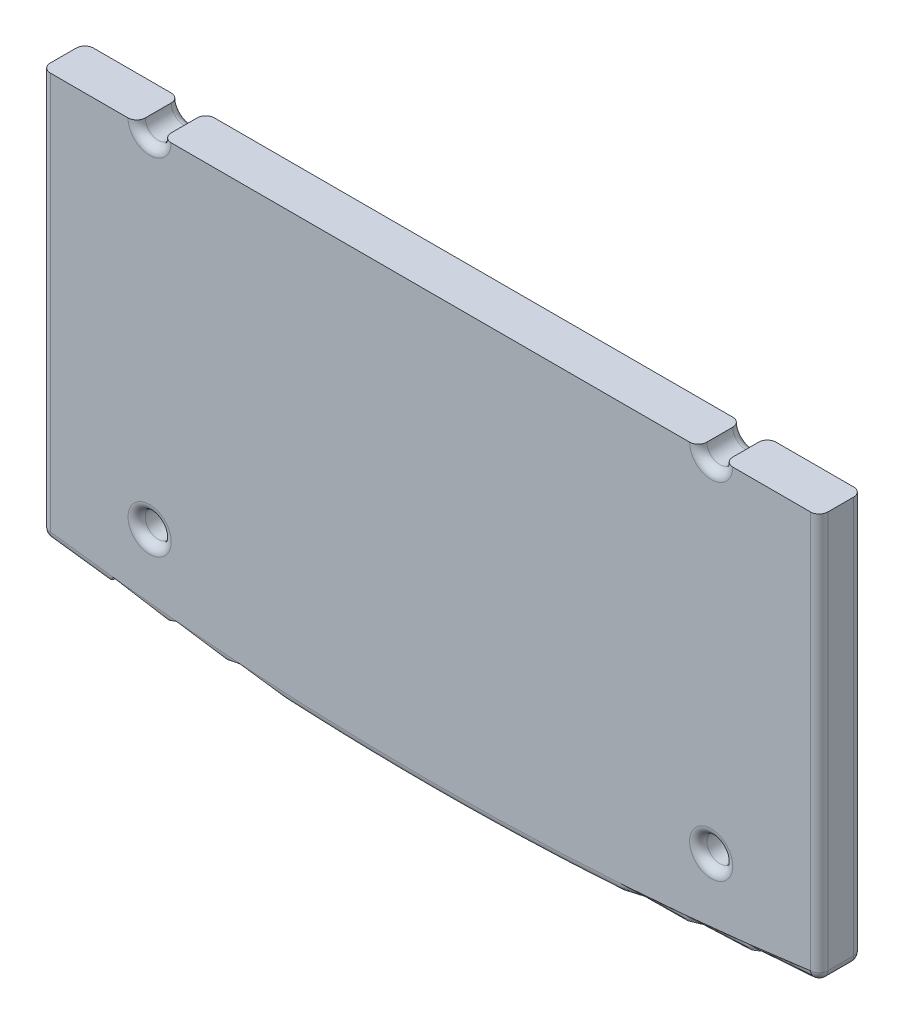
from build123d import *

# Parameters (mm, degrees)
SKETCH2_W                 = 180
SKETCH2_H                 = 180
BOSS_EXTRUDE1_DEPTH       = 10
SKETCH4_R                 = 3
CUT_EXTRUDE4_DEPTH        = 10
LPATTERN2_COUNT           = 2
LPATTERN2_PITCH           = 130
LPATTERN2_COUNT_DIR2      = 2
LPATTERN2_PITCH_DIR2      = 80
LPATTERN3_COUNT           = 2
LPATTERN3_PITCH           = 80
LPATTERN3_COPY_1_SKETCH_R = 3
LPATTERN3_COPY_1_DEPTH    = 10
LPATTERN3_COPY_2_SKETCH_R = 3
LPATTERN3_COPY_2_DEPTH    = 10
LPATTERN3_COPY_3_SKETCH_R = 3
LPATTERN3_COPY_3_DEPTH    = 10
FILLET1_R                 = 2
SKETCH5_W                 = 226.866804214
SKETCH5_H                 = 113.685590411
CUT_EXTRUDE5_DEPTH        = 10


with BuildPart() as part:
    # Sketch2 → Boss-Extrude1 (new body)
    with BuildSketch(Plane.XY):
        with Locations((0, -3.730444936)):
            Rectangle(SKETCH2_W, SKETCH2_H)
        with BuildLine():
            ThreePointArc((-90, 86.269555064), (0, 100), (90, 86.269555064))
            Line((90, 86.269555064), (-90, 86.269555064))
        make_face()
        with BuildLine():
            ThreePointArc((90, -93.730444936), (0, -100), (-90, -93.730444936))
            Line((-90, -93.730444936), (90, -93.730444936))
        make_face()
    extrude(amount=BOSS_EXTRUDE1_DEPTH)

    # Sketch4 → Cut-Extrude4 (cut)
    with BuildSketch(Plane.XY):
        with Locations((-65, 0)):
            Circle(SKETCH4_R)
    cut_extrude4 = extrude(amount=CUT_EXTRUDE4_DEPTH, mode=Mode.SUBTRACT)

    # LPattern2: Cut-Extrude4 2 × 2
    with Locations(*[(i * LPATTERN2_PITCH, -j * LPATTERN2_PITCH_DIR2, 0) for i in range(LPATTERN2_COUNT) for j in range(LPATTERN2_COUNT_DIR2) if (i, j) != (0, 0)]):
        add(cut_extrude4, mode=Mode.SUBTRACT)

    # LPattern3: Cut-Extrude4 ×2
    with Locations(*[(0, i * LPATTERN3_PITCH, 0) for i in range(1, LPATTERN3_COUNT)]):
        add(cut_extrude4, mode=Mode.SUBTRACT)

    # LPattern3 copy 1 sketch → LPattern3 copy 1 (cut)
    with BuildSketch(Plane.XY):
        with Locations((-65, 0)):
            Circle(LPATTERN3_COPY_1_SKETCH_R)
    extrude(amount=LPATTERN3_COPY_1_DEPTH, mode=Mode.SUBTRACT)

    # LPattern3 copy 2 sketch → LPattern3 copy 2 (cut)
    with BuildSketch(Plane(origin=(130, 80, 0), x_dir=(1, 0, 0), z_dir=(0, 0, 1))):
        with Locations((-65, 0)):
            Circle(LPATTERN3_COPY_2_SKETCH_R)
    extrude(amount=LPATTERN3_COPY_2_DEPTH, mode=Mode.SUBTRACT)

    # LPattern3 copy 3 sketch → LPattern3 copy 3 (cut)
    with BuildSketch(Plane(origin=(130, 0, 0), x_dir=(1, 0, 0), z_dir=(0, 0, 1))):
        with Locations((-65, 0)):
            Circle(LPATTERN3_COPY_3_SKETCH_R)
    extrude(amount=LPATTERN3_COPY_3_DEPTH, mode=Mode.SUBTRACT)

    # Fillet1
    fillet1_edges = [part.edges().sort_by_distance(p)[0] for p in [
        (0, 100, 10),
        (-90, -3.730444936, 10),
        (-68, 0, 0),
        (-68, 0, 10),
        (0, -100, 10),
        (62, 0, 10),
        (62, 0, 0),
        (-68, -80, 10),
        (-68, -80, 0),
        (62, -80, 10),
        (62, -80, 0),
        (62, 80, 0),
        (62, 80, 10),
        (-68, 80, 0),
        (-68, 80, 10),
        (90, -3.730444936, 10),
        (0, -100, 0),
        (-90, -3.730444936, 0),
        (0, 100, 0),
        (90, -3.730444936, 0),
        (90, -93.730444936, 5),
        (-90, -93.730444936, 5),
        (-90, 86.269555064, 5),
        (90, 86.269555064, 5),
    ]]
    fillet(fillet1_edges, radius=FILLET1_R)

    # Sketch5 → Cut-Extrude5 (cut)
    with BuildSketch(Plane.XY.offset(10)):
        with Locations((11.118369718, 56.842795206)):
            Rectangle(SKETCH5_W, SKETCH5_H)
    extrude(amount=-CUT_EXTRUDE5_DEPTH, mode=Mode.SUBTRACT)


solid = part.part
